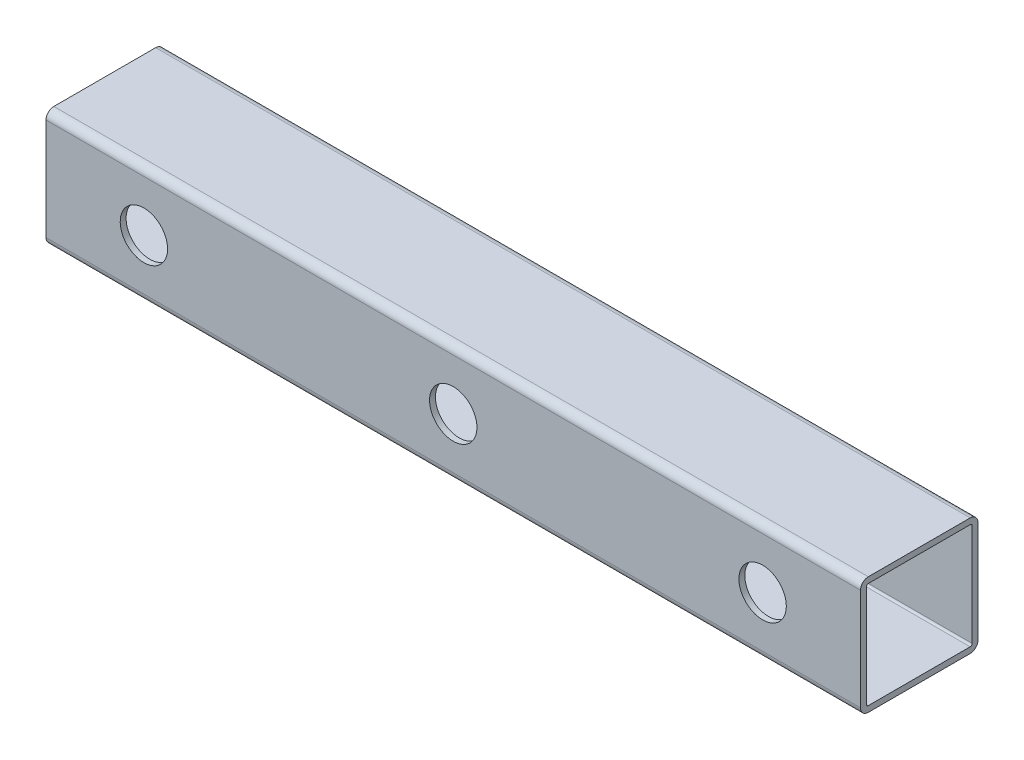
from build123d import *

# Parameters (mm, degrees)
EXTRUDE_1_DEPTH     = 208
CUT_EXTRUDE_5_REACH = 220.55
SKETCH_10_R         = 12.1


with BuildPart() as part:
    # Эскиз1 → Бобышка-Вытянуть1 (new, symmetric)
    with BuildSketch(Plane(origin=(0, 0, 0), x_dir=(0, 0, -1), z_dir=(1, 0, 0))):
        with BuildLine():
            Line((-26, -30), (26, -30))
            ThreePointArc((26, -30), (28.828427125, -28.828427125), (30, -26))
            Line((30, -26), (30, 26))
            ThreePointArc((30, 26), (28.828427125, 28.828427125), (26, 30))
            Line((26, 30), (-26, 30))
            ThreePointArc((-26, 30), (-28.828427125, 28.828427125), (-30, 26))
            Line((-30, 26), (-30, -26))
            ThreePointArc((-30, -26), (-28.828427125, -28.828427125), (-26, -30))
        make_face()
        with BuildLine():
            Line((-26, 27), (26, 27))
            ThreePointArc((26, 27), (26.707106781, 26.707106781), (27, 26))
            Line((27, 26), (27, -26))
            ThreePointArc((27, -26), (26.707106781, -26.707106781), (26, -27))
            Line((26, -27), (-26, -27))
            ThreePointArc((-26, -27), (-26.707106781, -26.707106781), (-27, -26))
            Line((-27, -26), (-27, 26))
            ThreePointArc((-27, 26), (-26.707106781, 26.707106781), (-26, 27))
        make_face(mode=Mode.SUBTRACT)
    extrude(amount=EXTRUDE_1_DEPTH, both=True)

    # Вырез-Вытянуть5: up to this face of the body (flat: up to its plane)
    cut_extrude_5_end = Plane(part.part.faces().sort_by_distance((0, 0, 30))[0])
    # Эскиз10 → Вырез-Вытянуть5 (cut, up to the picked face)
    with BuildSketch(Plane(origin=(0, 0, -30), x_dir=(-1, 0, 0), z_dir=(0, 0, -1)), mode=Mode.PRIVATE) as cut_extrude_5_sk1:
        with Locations(Location((-158, 0, 0), (0, 0, 90))):
            Circle(SKETCH_10_R)
    cut_extrude_5_tool1 = split(extrude(cut_extrude_5_sk1.sketch, amount=-CUT_EXTRUDE_5_REACH, mode=Mode.PRIVATE), bisect_by=cut_extrude_5_end, keep=Keep.BOTH, mode=Mode.PRIVATE)
    # Эскиз10 → Вырез-Вытянуть5 (cut, up to the picked face)
    with BuildSketch(Plane(origin=(0, 0, -30), x_dir=(-1, 0, 0), z_dir=(0, 0, -1)), mode=Mode.PRIVATE) as cut_extrude_5_sk2:
        with Locations(Location((158, 0, 0), (0, 0, 270))):
            Circle(SKETCH_10_R)
    cut_extrude_5_tool2 = split(extrude(cut_extrude_5_sk2.sketch, amount=-CUT_EXTRUDE_5_REACH, mode=Mode.PRIVATE), bisect_by=cut_extrude_5_end, keep=Keep.BOTH, mode=Mode.PRIVATE)
    # Эскиз10 → Вырез-Вытянуть5 (cut, up to the picked face)
    with BuildSketch(Plane(origin=(0, 0, -30), x_dir=(-1, 0, 0), z_dir=(0, 0, -1)), mode=Mode.PRIVATE) as cut_extrude_5_sk3:
        with Locations(Location((0, 0, 0), (0, 0, 90))):
            Circle(SKETCH_10_R)
    cut_extrude_5_tool3 = split(extrude(cut_extrude_5_sk3.sketch, amount=-CUT_EXTRUDE_5_REACH, mode=Mode.PRIVATE), bisect_by=cut_extrude_5_end, keep=Keep.BOTH, mode=Mode.PRIVATE)
    add(cut_extrude_5_tool1.solids().sort_by(Axis((158, 0, -30), (0, 0, 1)))[0], mode=Mode.SUBTRACT)
    add(cut_extrude_5_tool2.solids().sort_by(Axis((-158, 0, -30), (0, 0, 1)))[0], mode=Mode.SUBTRACT)
    add(cut_extrude_5_tool3.solids().sort_by(Axis((0, 0, -30), (0, 0, 1)))[0], mode=Mode.SUBTRACT)


solid = part.part
